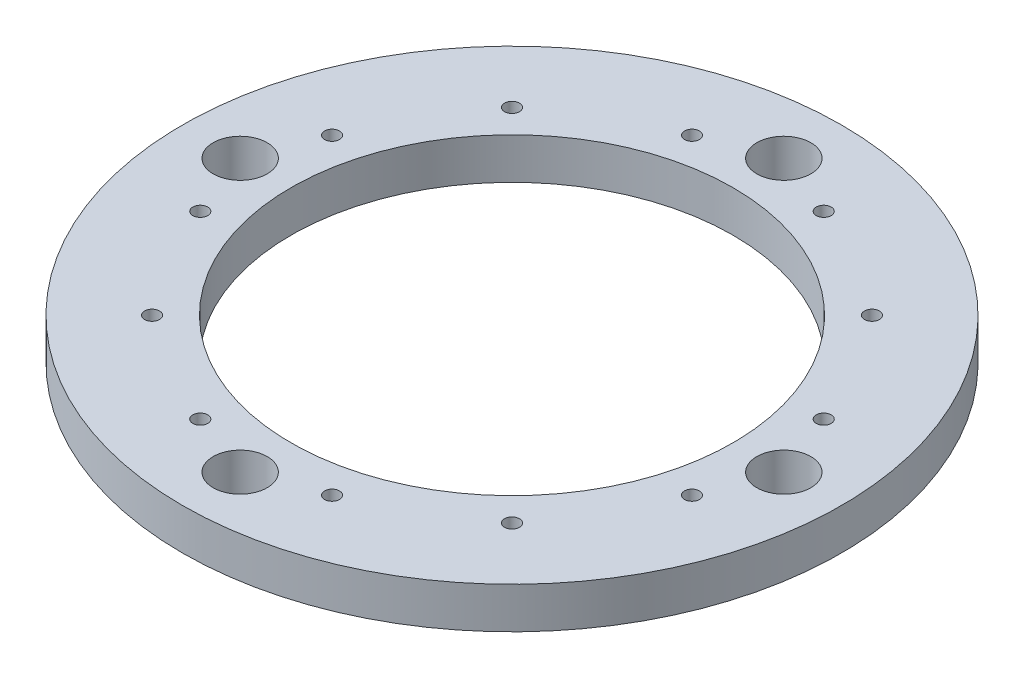
from build123d import *

# Parameters (mm, degrees)
SKETCH1_R           = 76.2
SKETCH1_R_2         = 51.1048
BOSS_EXTRUDE1_DEPTH = 9.525
SKETCH2_R           = 1.7272
CUT_EXTRUDE1_DEPTH  = 109.183203987
SKETCH3_R           = 6.249999946
CUT_EXTRUDE2_DEPTH  = 109.183203987


with BuildPart() as part:
    # Sketch1 → Boss-Extrude1 (new body)
    with BuildSketch(Plane(origin=(0, 0, 0), x_dir=(1, 0, 0), z_dir=(0, 1, 0))):
        with Locations(Location((0, 0, 0), (0, 0, 90))):
            Circle(SKETCH1_R)
        with Locations(Location((0, 0, 0), (0, 0, 90))):
            Circle(SKETCH1_R_2, mode=Mode.SUBTRACT)
    extrude(amount=BOSS_EXTRUDE1_DEPTH)

    # Sketch2 → Cut-Extrude1 (cut, through all)
    with BuildSketch(Plane(origin=(0, 9.525, 0), x_dir=(1, 0, 0), z_dir=(0, 1, 0))):
        with Locations(Location((-15.231500779, 56.844734782, 0), (0, 0, 270))):
            Circle(SKETCH2_R)
        with Locations(Location((15.231500779, 56.844734782, 0), (0, 0, 270))):
            Circle(SKETCH2_R)
        with Locations(Location((41.613234004, 41.613234004, 0), (0, 0, 270))):
            Circle(SKETCH2_R)
        with Locations(Location((56.844734782, 15.231500779, 0), (0, 0, 270))):
            Circle(SKETCH2_R)
        with Locations(Location((56.844734782, -15.231500779, 0), (0, 0, 270))):
            Circle(SKETCH2_R)
        with Locations(Location((41.613234004, -41.613234004, 0), (0, 0, 270))):
            Circle(SKETCH2_R)
        with Locations(Location((15.231500779, -56.844734782, 0), (0, 0, 270))):
            Circle(SKETCH2_R)
        with Locations(Location((-15.231500779, -56.844734782, 0), (0, 0, 270))):
            Circle(SKETCH2_R)
        with Locations(Location((-41.613234004, -41.613234004, 0), (0, 0, 270))):
            Circle(SKETCH2_R)
        with Locations(Location((-56.844734782, -15.231500779, 0), (0, 0, 270))):
            Circle(SKETCH2_R)
        with Locations(Location((-56.844734782, 15.231500779, 0), (0, 0, 270))):
            Circle(SKETCH2_R)
        with Locations(Location((-41.613234004, 41.613234004, 0), (0, 0, 270))):
            Circle(SKETCH2_R)
    extrude(amount=-CUT_EXTRUDE1_DEPTH, mode=Mode.SUBTRACT)

    # Sketch3 → Cut-Extrude2 (cut, through all)
    with BuildSketch(Plane(origin=(0, 9.525, 0), x_dir=(1, 0, 0), z_dir=(0, 1, 0))):
        with Locations(Location((-62.85000003, 0, 0), (0, 0, 270))):
            Circle(SKETCH3_R)
        with Locations(Location((0, 62.85000003, 0), (0, 0, 270))):
            Circle(SKETCH3_R)
        with Locations(Location((62.85000003, 0, 0), (0, 0, 270))):
            Circle(SKETCH3_R)
        with Locations(Location((0, -62.85000003, 0), (0, 0, 270))):
            Circle(SKETCH3_R)
    extrude(amount=-CUT_EXTRUDE2_DEPTH, mode=Mode.SUBTRACT)


solid = part.part
